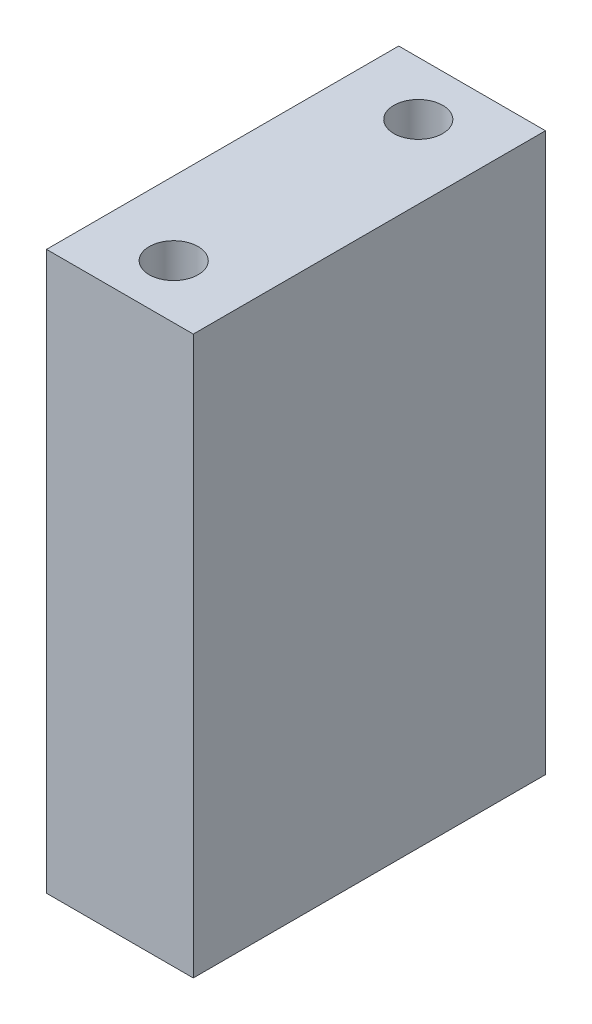
from build123d import *

# Parameters (mm, degrees)
SKETCH1_W             = 15
SKETCH1_H             = 36
BOSS_EXTRUDE1_DEPTH   = 57
M6_TAPPED_HOLE1_D     = 5
M6_TAPPED_HOLE1_DEPTH = 15
M6_TAPPED_HOLE1_TIP   = 1.502151548


with BuildPart() as part:
    # Sketch1 → Boss-Extrude1 (new body)
    with BuildSketch(Plane(origin=(0, 0, 0), x_dir=(1, 0, 0), z_dir=(0, 1, 0))):
        Rectangle(SKETCH1_W, SKETCH1_H)
    extrude(amount=-BOSS_EXTRUDE1_DEPTH)

    # M6 Tapped Hole1
    with Locations(Plane(origin=(0, 0, 0), x_dir=(1, 0, 0), z_dir=(0, 1, 0))):
        with Locations((0, 12.5), (0, -12.5)):
            Hole(M6_TAPPED_HOLE1_D / 2, depth=M6_TAPPED_HOLE1_DEPTH)
            with Locations((0, 0, -(M6_TAPPED_HOLE1_DEPTH + M6_TAPPED_HOLE1_TIP / 2))):  # 118° drill point
                Cone(0, M6_TAPPED_HOLE1_D / 2, M6_TAPPED_HOLE1_TIP, mode=Mode.SUBTRACT)


solid = part.part
